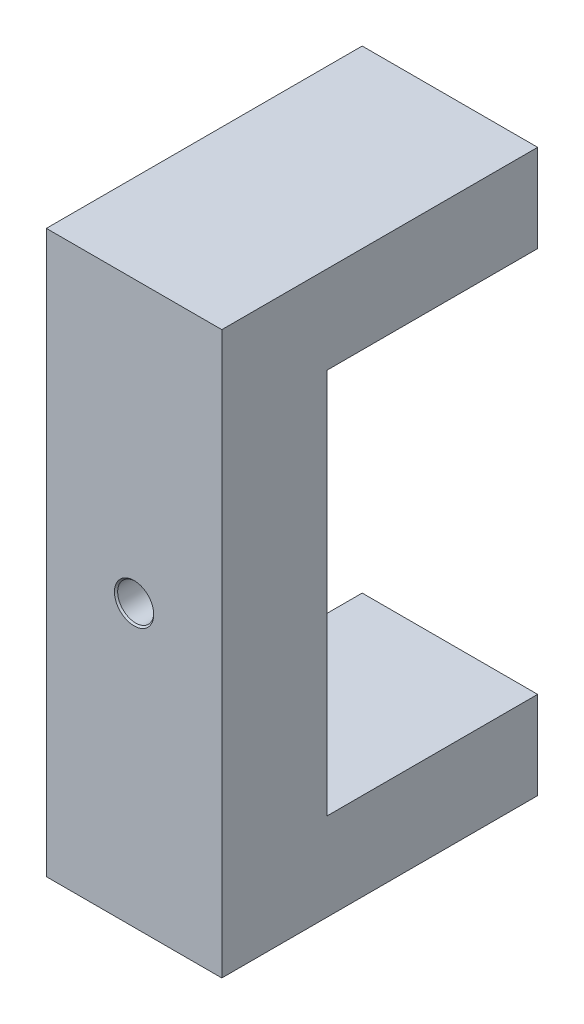
from build123d import *

# Parameters (mm, degrees)
BOSS_EXTRUDE1_DEPTH = 15.875


with BuildPart() as part:
    # Sketch1 → Boss-Extrude1 (new, symmetric)
    with BuildSketch(Plane(origin=(0, 0, 0), x_dir=(0, 0, -1), z_dir=(1, 0, 0))):
        Polygon((0, 34.925), (0, 50.8), (-57.15, 50.8), (-57.15, -50.8), (0, -50.8), (0, -34.925), (-38.1, -34.925), (-38.1, 34.925), align=None)
    extrude(amount=BOSS_EXTRUDE1_DEPTH, both=True)

    # Sketch2 → F (0.257) Diameter Hole1 (revolve, cut)
    with BuildSketch(Plane(origin=(0, 0, 57.15), x_dir=(0, -1, 0), z_dir=(1, 0, 0))):
        Polygon((0, 0), (0, 19.05), (3.556, 19.05), (3.2639, 18.7579), (3.2639, 0.2921), (3.556, 0), align=None)
    revolve(axis=Axis((0, 0, 63.5), (0, 0, -1)), mode=Mode.SUBTRACT)


solid = part.part
